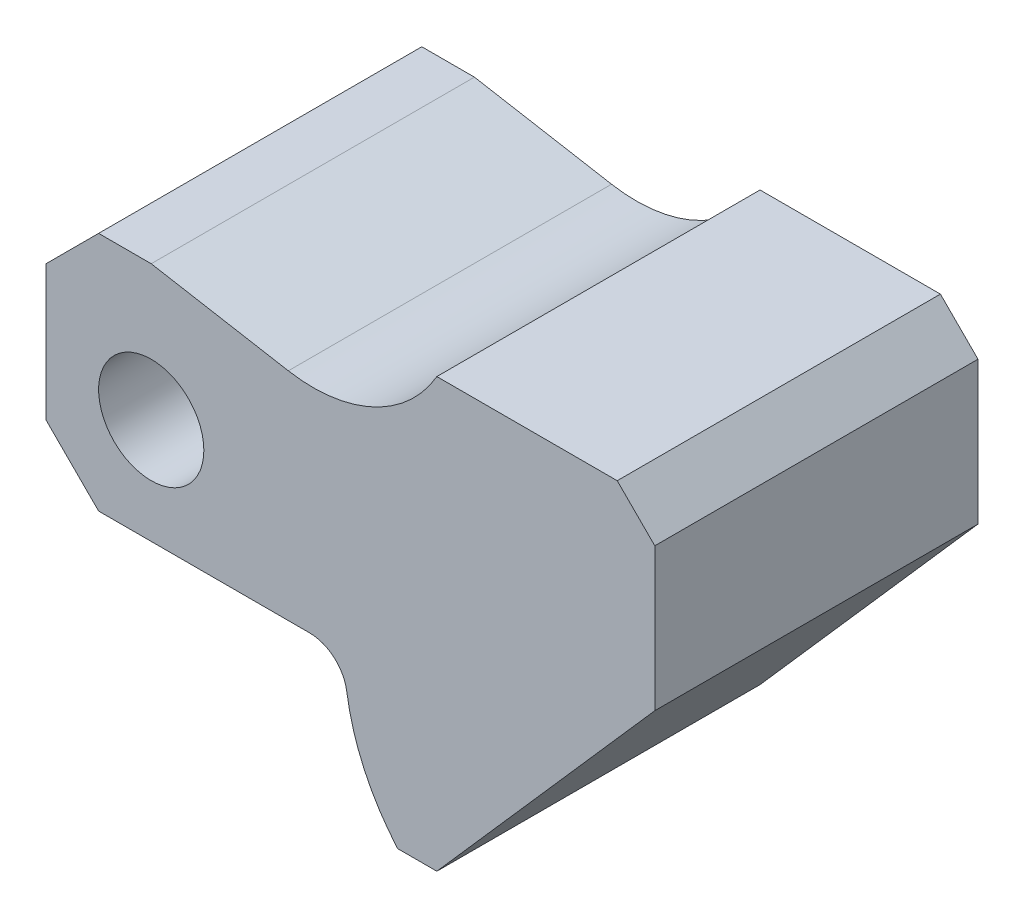
from build123d import *

# Parameters (mm, degrees)
SKETCH_2_R      = 7
EXTRUDE_1_DEPTH = 43


with BuildPart() as part:
    # 草圖2 → 填料-伸長1 (new body)
    with BuildSketch(Plane.XY):
        with BuildLine():
            Line((-14, 11), (-14, -7))
            Line((-14, -7), (-7, -14))
            Line((-7, -14), (21.066626255, -14))
            ThreePointArc((21.066626255, -14), (24.331862036, -15.213413768), (26.012264997, -18.264705882))
            ThreePointArc((26.012264997, -18.264705882), (28.3490952, -26.115672061), (32.788067397, -33))
            Line((32.788067397, -33), (38, -33))
            Line((38, -33), (67, 0))
            Line((67, 0), (67, 19))
            Line((67, 19), (62, 24))
            Line((62, 24), (38, 24))
            ThreePointArc((38, 24), (29.574972961, 16.276069151), (18.243084988, 14.783251905))
            Line((18.243084988, 14.783251905), (0, 18))
            Line((0, 18), (-7, 18))
            Line((-7, 18), (-14, 11))
        make_face()
        Circle(SKETCH_2_R, mode=Mode.SUBTRACT)
    extrude(amount=EXTRUDE_1_DEPTH)


solid = part.part
